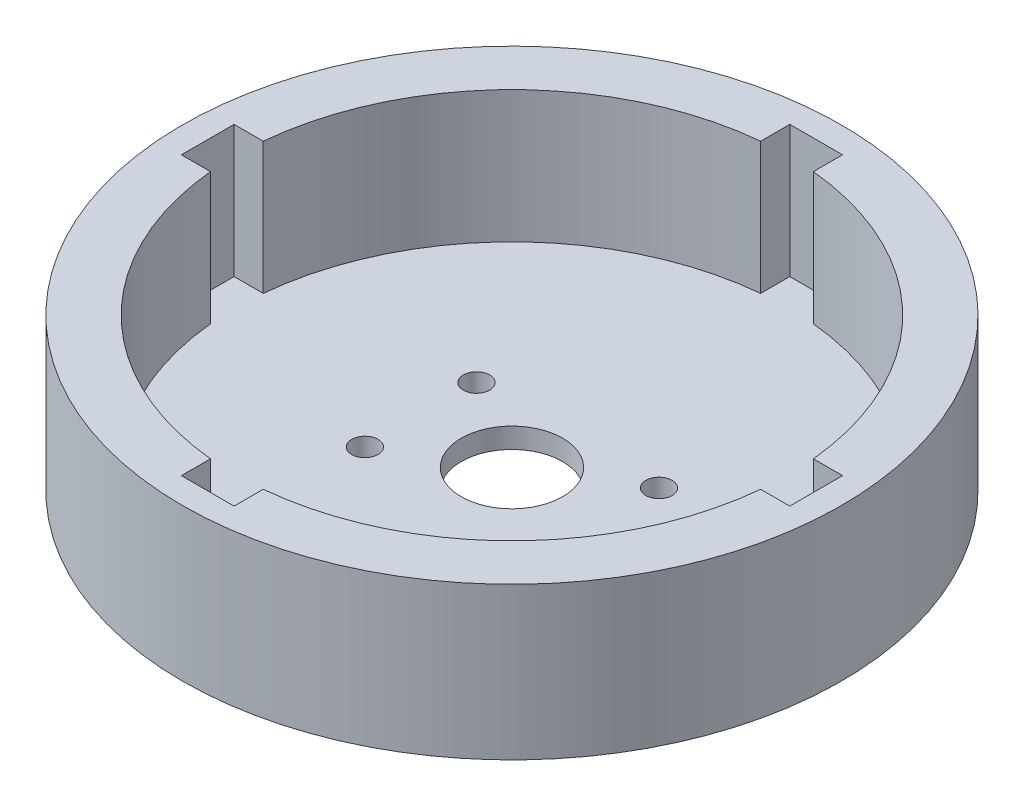
from build123d import *

# Parameters (mm, degrees)
SKETCH1_R           = 32.5
BOSS_EXTRUDE1_DEPTH = 2
SKETCH2_R           = 32.5
BOSS_EXTRUDE2_DEPTH = 13
CUT_EXTRUDE2_REACH  = 50.348
SKETCH3_R           = 5
CUT_EXTRUDE3_REACH  = 50.348
SKETCH5_R           = 1.3


with BuildPart() as part:
    # Sketch1 → Boss-Extrude1 (new body)
    with BuildSketch(Plane(origin=(0, 0, 0), x_dir=(1, 0, 0), z_dir=(0, 1, 0))):
        with Locations(Location((0, 0, 0), (0, 0, 270))):
            Circle(SKETCH1_R)
    extrude(amount=BOSS_EXTRUDE1_DEPTH)

    # Sketch2 → Boss-Extrude2 (add)
    with BuildSketch(Plane(origin=(0, 2, 0), x_dir=(1, 0, 0), z_dir=(0, 1, 0))):
        with Locations(Location((0, 0, 0), (0, 0, 270))):
            Circle(SKETCH2_R)
        with BuildLine():
            Line((2.6, -27.125679715), (2.6, -30))
            Line((2.6, -30), (-2.6, -30))
            Line((-2.6, -30), (-2.6, -27.125679715))
            ThreePointArc((-2.6, -27.125679715), (-19.268659787, -19.268659787), (-27.125679715, -2.6))
            Line((-27.125679715, -2.6), (-30, -2.6))
            Line((-30, -2.6), (-30, 2.6))
            Line((-30, 2.6), (-27.125679715, 2.6))
            ThreePointArc((-27.125679715, 2.6), (-19.268659787, 19.268659787), (-2.6, 27.125679715))
            Line((-2.6, 27.125679715), (-2.6, 30))
            Line((-2.6, 30), (2.6, 30))
            Line((2.6, 30), (2.6, 27.125679715))
            ThreePointArc((2.6, 27.125679715), (19.268659787, 19.268659787), (27.125679715, 2.6))
            Line((27.125679715, 2.6), (30, 2.6))
            Line((30, 2.6), (30, -2.6))
            Line((30, -2.6), (27.125679715, -2.6))
            ThreePointArc((27.125679715, -2.6), (19.268659787, -19.268659787), (2.6, -27.125679715))
        make_face(mode=Mode.SUBTRACT)
    extrude(amount=BOSS_EXTRUDE2_DEPTH)

    # Sketch3 → Cut-Extrude2 (cut, up to next)
    with BuildSketch(Plane.XZ, mode=Mode.PRIVATE) as cut_extrude2_sk1:
        with Locations(Location((0, 0, 0), (0, 0, 270))):
            Circle(SKETCH3_R)
    cut_extrude2_tool1 = extrude(cut_extrude2_sk1.sketch, amount=-CUT_EXTRUDE2_REACH, mode=Mode.PRIVATE) & part.part
    add(cut_extrude2_tool1.solids().sort_by_distance((0, 0, 0))[0], mode=Mode.SUBTRACT)

    # Sketch5 → Cut-Extrude3 (cut, up to next)
    with BuildSketch(Plane.XZ, mode=Mode.PRIVATE) as cut_extrude3_sk1:
        with Locations(Location((9, 5.5, 0), (0, 0, 270))):
            Circle(SKETCH5_R)
    cut_extrude3_tool1 = extrude(cut_extrude3_sk1.sketch, amount=-CUT_EXTRUDE3_REACH, mode=Mode.PRIVATE) & part.part
    # Sketch5 → Cut-Extrude3 (cut, up to next)
    with BuildSketch(Plane.XZ, mode=Mode.PRIVATE) as cut_extrude3_sk2:
        with Locations(Location((9, -5.5, 0), (0, 0, 270))):
            Circle(SKETCH5_R)
    cut_extrude3_tool2 = extrude(cut_extrude3_sk2.sketch, amount=-CUT_EXTRUDE3_REACH, mode=Mode.PRIVATE) & part.part
    # Sketch5 → Cut-Extrude3 (cut, up to next)
    with BuildSketch(Plane.XZ, mode=Mode.PRIVATE) as cut_extrude3_sk3:
        with Locations(Location((-9, -5.5, 0), (0, 0, 270))):
            Circle(SKETCH5_R)
    cut_extrude3_tool3 = extrude(cut_extrude3_sk3.sketch, amount=-CUT_EXTRUDE3_REACH, mode=Mode.PRIVATE) & part.part
    # Sketch5 → Cut-Extrude3 (cut, up to next)
    with BuildSketch(Plane.XZ, mode=Mode.PRIVATE) as cut_extrude3_sk4:
        with Locations(Location((-9, 5.5, 0), (0, 0, 270))):
            Circle(SKETCH5_R)
    cut_extrude3_tool4 = extrude(cut_extrude3_sk4.sketch, amount=-CUT_EXTRUDE3_REACH, mode=Mode.PRIVATE) & part.part
    add(cut_extrude3_tool1.solids().sort_by_distance((9, 0, 5.5))[0], mode=Mode.SUBTRACT)
    add(cut_extrude3_tool2.solids().sort_by_distance((9, 0, -5.5))[0], mode=Mode.SUBTRACT)
    add(cut_extrude3_tool3.solids().sort_by_distance((-9, 0, -5.5))[0], mode=Mode.SUBTRACT)
    add(cut_extrude3_tool4.solids().sort_by_distance((-9, 0, 5.5))[0], mode=Mode.SUBTRACT)


solid = part.part
